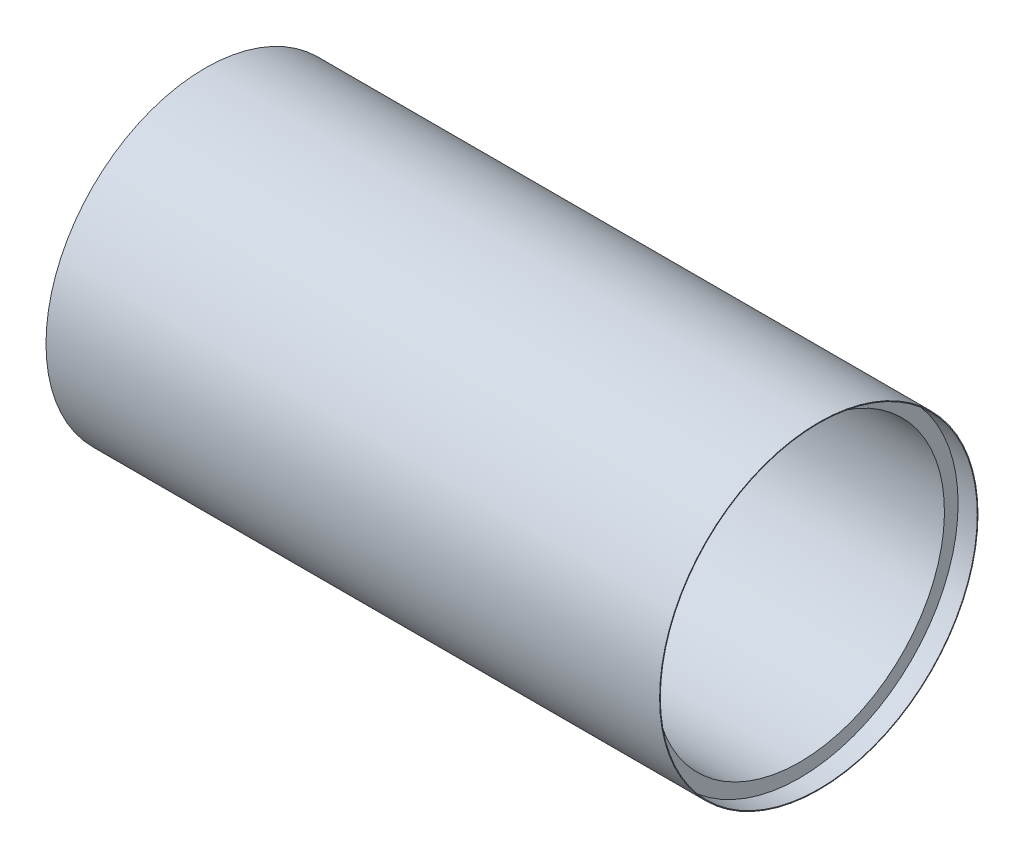
from build123d import *


with BuildPart() as part:
    # Sketch1 → Revolve1 (revolve)
    with BuildSketch(Plane.XY, mode=Mode.PRIVATE) as revolve1_sk:
        Polygon((39.146309032, 83.9724), (49.306309032, 83.9724), (49.306309032, 76.7334), (354.106309032, 76.7334), (354.106309032, 83.9724), (364.266309032, 83.9724), (364.266309032, 84.3534), (39.146309032, 84.3534), align=None)
    revolve(revolve1_sk.sketch.rotate(Axis((0, 0, 0), (1, 0, 0)), 180), axis=Axis((0, 0, 0), (1, 0, 0)))


solid = part.part
